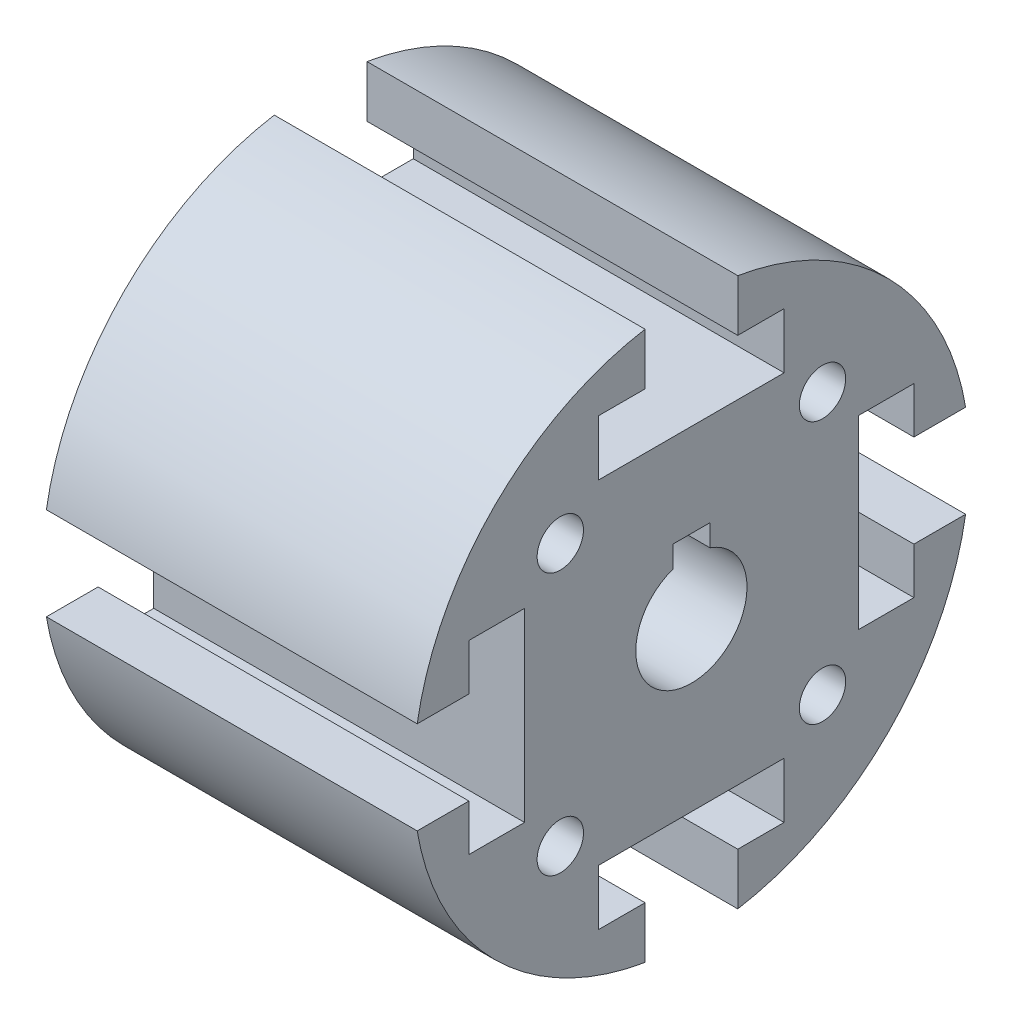
from build123d import *

# Parameters (mm, degrees)
EXTRUDE_1_DEPTH          = 10
EXTRUDE_1_DEPTH_BACK     = 10
SKETCH_1_R               = 15
SKETCH_2_R               = 3
CUT_EXTRUDE_1_DEPTH      = 30.154759474
CUT_EXTRUDE_2_DEPTH      = 30.154759474
M3X0_5_1_D               = 2.5
PATTERN_CIRCULAR_2_COUNT = 4
CUT_EXTRUDE_3_DEPTH      = 29.939592257


with BuildPart() as part:
    # ｽｹｯﾁ1 → ﾎﾞｽ - 押し出し1 (new, two sides: drawn at the far end of the back side and taken through both)
    with BuildSketch(Plane(origin=(0, 0, 0), x_dir=(0, 0, -1), z_dir=(1, 0, 0)).offset(-EXTRUDE_1_DEPTH_BACK)):
        Circle(SKETCH_1_R)
    extrude(amount=EXTRUDE_1_DEPTH + EXTRUDE_1_DEPTH_BACK)

    # ｽｹｯﾁ2 → ｶｯﾄ - 押し出し1 (cut, through all)
    with BuildSketch(Plane(origin=(10, 0, 0), x_dir=(0, 0, -1), z_dir=(1, 0, 0))):
        Circle(SKETCH_2_R)
    extrude(amount=-CUT_EXTRUDE_1_DEPTH, mode=Mode.SUBTRACT)

    # ｽｹｯﾁ3 → ｶｯﾄ - 押し出し2 (cut, through all)
    with BuildSketch(Plane(origin=(10, 0, 0), x_dir=(0, 0, -1), z_dir=(1, 0, 0))):
        Polygon((5, 12), (2.5, 12), (2.5, 15), (-2.5, 15), (-2.5, 12), (-5, 12), (-5, 9), (5, 9), align=None)
    cut_extrude_2 = extrude(amount=-CUT_EXTRUDE_2_DEPTH, mode=Mode.SUBTRACT)

    # M3x0.5 ねじ穴1 (through all)
    with Locations(Plane(origin=(10, 0, 0), x_dir=(0, 0, -1), z_dir=(1, 0, 0))):
        with Locations((-7.071067812, 7.071067812), (7.071067812, -7.071067812), (7.071067812, 7.071067812), (-7.071067812, -7.071067812)):
            Hole(M3X0_5_1_D / 2)

    # 円形ﾊﾟﾀｰﾝ2: ｶｯﾄ - 押し出し2 ×4 about axis
    pattern_circular_2_axis = Axis((-10, 0, 0), (1, 0, 0))
    for i in range(1, PATTERN_CIRCULAR_2_COUNT):
        add(cut_extrude_2.rotate(pattern_circular_2_axis, i * 360 / PATTERN_CIRCULAR_2_COUNT), mode=Mode.SUBTRACT)

    # ｽｹｯﾁ7 → ｶｯﾄ - 押し出し3 (cut, through all)
    with BuildSketch(Plane(origin=(10, 0, 0), x_dir=(0, 0, -1), z_dir=(1, 0, 0))):
        with BuildLine():
            Line((-1, 4), (1, 4))
            Line((1, 4), (1, 3))
            Line((1, 3), (1, 2.828427125))
            ThreePointArc((1, 2.828427125), (0, 3), (-1, 2.828427125))
            Line((-1, 2.828427125), (-1, 3))
            Line((-1, 3), (-1, 4))
        make_face()
    extrude(amount=-CUT_EXTRUDE_3_DEPTH, mode=Mode.SUBTRACT)


solid = part.part
